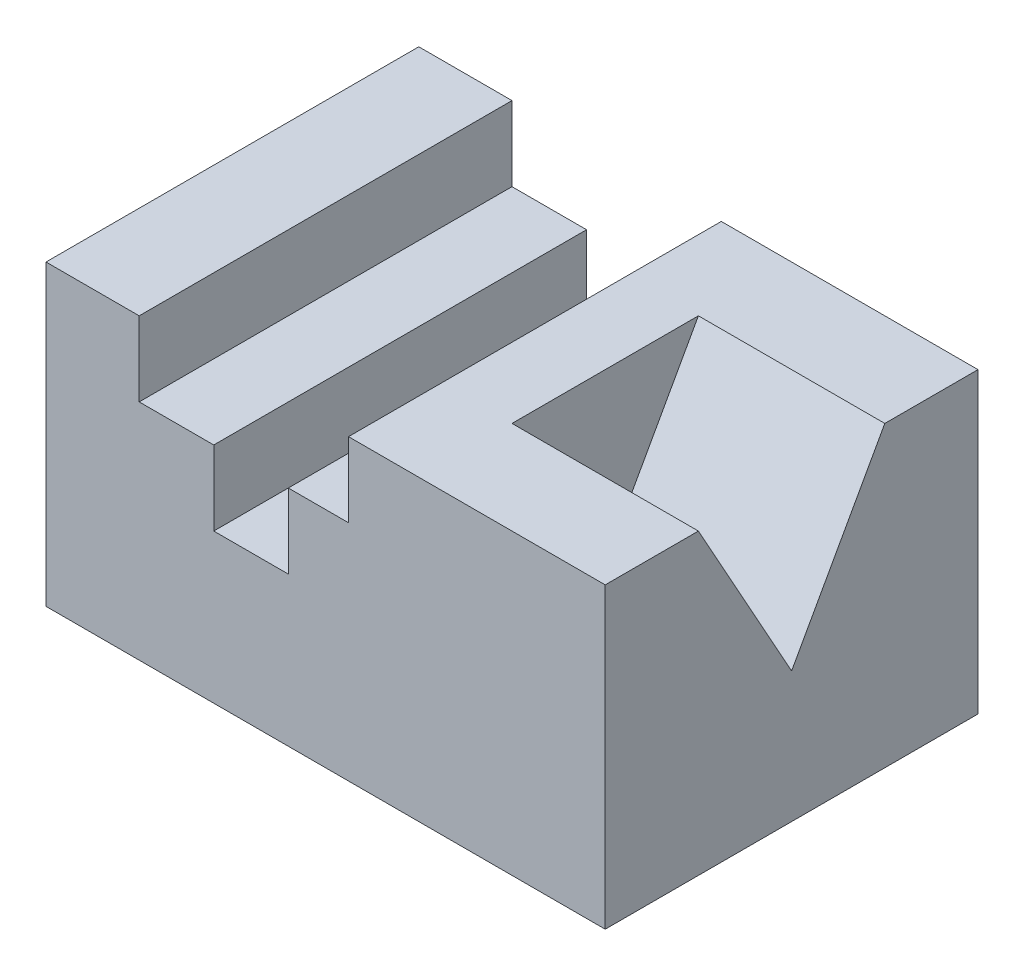
from build123d import *

# Parameters (mm, degrees)
SKETCH2_W               = 150
SKETCH2_H               = 80
BOSS_EXTRUDE1_DEPTH     = 100
CUT_EXTRUDE1_DEPTH      = 142.794426811
CUT_EXTRUDE1_DEPTH_BACK = 100
CUT_EXTRUDE2_DEPTH      = 186.671040169
CUT_EXTRUDE2_DEPTH_BACK = 50


with BuildPart() as part:
    # Sketch2 → Boss-Extrude1 (new body)
    with BuildSketch(Plane.XY):
        with Locations((15.177182909, 4.426739215)):
            Rectangle(SKETCH2_W, SKETCH2_H)
    extrude(amount=-BOSS_EXTRUDE1_DEPTH)

    # Sketch3 → Cut-Extrude1 (cut, two sides: drawn at the far end of the back side and taken through both)
    with BuildSketch(Plane.XY.offset(-CUT_EXTRUDE1_DEPTH_BACK)):
        Polygon((-409.822817091, 44.426739215), (-59.822817091, 44.426739215), (-34.822817091, 44.426739215), (-34.822817091, 24.426739215), (-14.822817091, 24.426739215), (-14.822817091, 4.426739215), (5.177182909, 4.426739215), (5.177182909, 24.426739215), (21.319701193, 24.426739215), (21.319701193, 44.426739215), (21.319701193, 394.426739215), (-419.864809368, 937.89359896), (-851.007327651, 587.89359896), align=None)
    extrude(amount=CUT_EXTRUDE1_DEPTH + CUT_EXTRUDE1_DEPTH_BACK, mode=Mode.SUBTRACT)

    # Sketch5 → Cut-Extrude2 (cut, two sides: drawn at the far end of the back side and taken through both)
    with BuildSketch(Plane(origin=(90.177182909, 0, 0), x_dir=(0, 0, -1), z_dir=(1, 0, 0)).offset(-CUT_EXTRUDE2_DEPTH_BACK)):
        Polygon((-86.366239295, 244.885969946), (25, 44.426739215), (50, -0.573260785), (75, 44.426739215), (186.366239295, 244.885969946), (186.366239295, 703.520213935), (-86.366239295, 703.520213935), align=None)
    extrude(amount=CUT_EXTRUDE2_DEPTH + CUT_EXTRUDE2_DEPTH_BACK, mode=Mode.SUBTRACT)


solid = part.part
